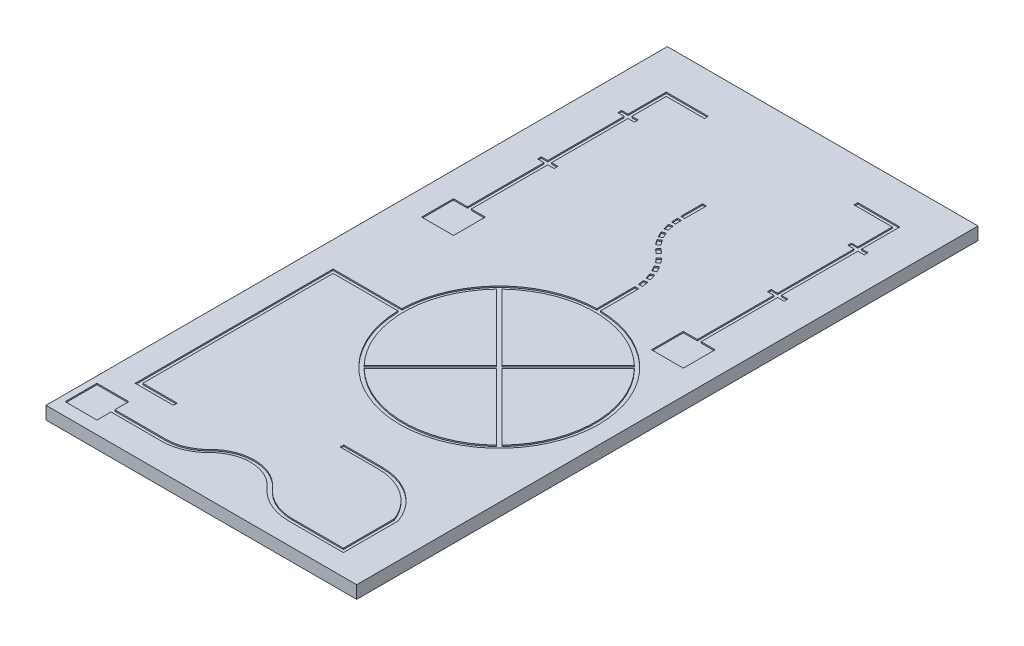
from build123d import *

# Parameters (mm, degrees)
SKETCH1_W           = 2438.4
SKETCH1_H           = 4876.8
BOSS_EXTRUDE1_DEPTH = 100
SKETCH2_W           = 29.994
SKETCH2_H           = 170.927857272
CUT_EXTRUDE1_DEPTH  = 10


with BuildPart() as part:
    # Sketch1 → Boss-Extrude1 (new body)
    with BuildSketch(Plane(origin=(0, 0, 0), x_dir=(1, 0, 0), z_dir=(0, 1, 0))):
        Rectangle(SKETCH1_W, SKETCH1_H)
    extrude(amount=BOSS_EXTRUDE1_DEPTH)

    # Sketch2 → Cut-Extrude1 (cut)
    # profile 1 of 14: a face of its own
    with BuildSketch(Plane(origin=(0, 100, 0), x_dir=(1, 0, 0), z_dir=(0, 1, 0))):
        with BuildLine():
            Line((948.697268509, -2271.953299987), (948.697268509, -1841.953299987))
            ThreePointArc((948.697268509, -1841.953299987), (781.677972321, -1622.395299678), (518.697268509, -1539.074772669))
            Line((518.697268509, -1539.074772669), (218.697268509, -1539.074772669))
            Line((218.697268509, -1539.074772669), (218.697268509, -1567.203186754))
            Line((218.697268509, -1567.203186754), (518.697268509, -1567.203186754))
            ThreePointArc((518.697268509, -1567.203186754), (761.332604312, -1642.506806454), (918.697268509, -1841.953299987))
            Line((918.697268509, -1841.953299987), (918.697268509, -2241.953299987))
            Line((918.697268509, -2241.953299987), (518.697268509, -2241.953299987))
            ThreePointArc((518.697268509, -2241.953299987), (360.930329193, -2207.702777647), (231.567262992, -2111.117569023))
            ThreePointArc((231.567262992, -2111.117569023), (-19.994263519, -1992.142953693), (-277.909673512, -2096.631240126))
            ThreePointArc((-277.909673512, -2096.631240126), (-388.263085664, -2171.917017743), (-519.2, -2198.4))
            Line((-519.2, -2198.4), (-919.2, -2198.4))
            Line((-919.2, -2198.4), (-919.2, -2088.4))
            Line((-919.2, -2088.4), (-1169.2, -2088.4))
            Line((-1169.2, -2088.4), (-1169.2, -2338.4))
            Line((-1169.2, -2338.4), (-919.2, -2338.4))
            Line((-919.2, -2338.4), (-919.2, -2228.4))
            Line((-919.2, -2228.4), (-519.2, -2228.4))
            ThreePointArc((-519.2, -2228.4), (-376.604559833, -2199.558992626), (-256.425361631, -2117.569825155))
            ThreePointArc((-256.425361631, -2117.569825155), (-20.846930763, -2022.130833888), (208.9279, -2130.801553459))
            ThreePointArc((208.9279, -2130.801553459), (348.490866445, -2235.002223915), (518.697268509, -2271.953299987))
            Line((518.697268509, -2271.953299987), (948.697268509, -2271.953299987))
        make_face()
    # profile 2 of 14: a face of its own
    with BuildSketch(Plane(origin=(0, 100, 0), x_dir=(1, 0, 0), z_dir=(0, 1, 0))):
        with BuildLine():
            Line((285, 379.855755893), (285, 679.855755893))
            Line((285, 679.855755893), (315, 679.855755893))
            Line((315, 679.855755893), (315, 379.855755893))
            ThreePointArc((315, 379.855755893), (851.543289326, -951.543289326), (-479.855755893, -415))
            Line((-479.855755893, -415), (-989.2, -415))
            Line((-989.2, -415), (-989.2, -1908.4))
            Line((-989.2, -1908.4), (-719.2, -1908.4))
            Line((-719.2, -1908.4), (-719.2, -1938.4))
            Line((-719.2, -1938.4), (-1019.2, -1938.4))
            Line((-1019.2, -1938.4), (-1019.2, -385))
            Line((-1019.2, -385), (-479.855755893, -385))
            ThreePointArc((-479.855755893, -385), (-251.543289326, 151.543289326), (285, 379.855755893))
        make_face()
        with BuildLine():
            ThreePointArc((840.830091248, -919.617948498), (1050, -399.999999989), (840.830091233, 119.617948514))
            Line((840.830091233, 119.617948514), (321.212142749, -399.999999999))
            Line((321.212142749, -399.999999999), (840.830091248, -919.617948498))
        make_face(mode=Mode.SUBTRACT)
        with BuildLine():
            ThreePointArc((-240.830091247, 119.617948498), (-450, -399.99999999), (-240.830091262, -919.617948483))
            Line((-240.830091262, -919.617948483), (278.78785725, -400))
            Line((278.78785725, -400), (-240.830091247, 119.617948498))
        make_face(mode=Mode.SUBTRACT)
        with BuildLine():
            ThreePointArc((-219.617948483, -940.830091262), (300.00000001, -1150), (819.617948498, -940.830091248))
            Line((819.617948498, -940.830091248), (300, -421.21214275))
            Line((300, -421.21214275), (-219.617948483, -940.830091262))
        make_face(mode=Mode.SUBTRACT)
        with BuildLine():
            ThreePointArc((819.617948513, 140.830091233), (300.00000001, 350), (-219.617948498, 140.830091247))
            Line((-219.617948498, 140.830091247), (300.000000001, -378.787857251))
            Line((300.000000001, -378.787857251), (819.617948513, 140.830091233))
        make_face(mode=Mode.SUBTRACT)
    # profile 3 of 14: a face of its own
    with BuildSketch(Plane(origin=(0, 100, 0), x_dir=(1, 0, 0), z_dir=(0, 1, 0))):
        with BuildLine():
            Line((283.48537458, 707.243266979), (313.363780337, 709.855755893))
            ThreePointArc((313.363780337, 709.855755893), (310.509267678, 734.689146996), (306.307291752, 759.330351401))
            Line((306.307291752, 759.330351401), (276.889903298, 753.485568645))
            ThreePointArc((276.889903298, 753.485568645), (280.817354071, 730.454233152), (283.48537458, 707.243266979))
        make_face()
    # profile 4 of 14: a face of its own
    with BuildSketch(Plane(origin=(0, 100, 0), x_dir=(1, 0, 0), z_dir=(0, 1, 0))):
        with BuildLine():
            Line((270.333610539, 781.525596779), (299.292720231, 789.330351401))
            ThreePointArc((299.292720231, 789.330351401), (292.133221855, 813.280030714), (283.680743009, 836.804510677))
            Line((283.680743009, 836.804510677), (255.741601187, 825.898155504))
            ThreePointArc((255.741601187, 825.898155504), (263.641859342, 803.91058617), (270.333610539, 781.525596779))
        make_face()
    # profile 5 of 14: a face of its own
    with BuildSketch(Plane(origin=(0, 100, 0), x_dir=(1, 0, 0), z_dir=(0, 1, 0))):
        with BuildLine():
            ThreePointArc((243.628805062, 853.938183638), (233.035185878, 874.762268653), (221.323804893, 894.978866774))
            Line((221.323804893, 894.978866774), (246.857174792, 910.713899361))
            ThreePointArc((246.857174792, 910.713899361), (259.387170406, 889.084179851), (270.72127371, 866.804510677))
            Line((270.72127371, 866.804510677), (243.628805062, 853.938183638))
        make_face()
    # profile 6 of 14: a face of its own
    with BuildSketch(Plane(origin=(0, 100, 0), x_dir=(1, 0, 0), z_dir=(0, 1, 0))):
        with BuildLine():
            ThreePointArc((202.481901877, 923.018894908), (188.18918005, 941.500923663), (172.911659512, 959.177593325))
            Line((172.911659512, 959.177593325), (195.061065513, 979.40005714))
            ThreePointArc((195.061065513, 979.40005714), (211.406470515, 960.487804723), (226.698240294, 940.713899361))
            Line((226.698240294, 940.713899361), (202.481901877, 923.018894908))
        make_face()
    # profile 7 of 14: a face of its own
    with BuildSketch(Plane(origin=(0, 100, 0), x_dir=(1, 0, 0), z_dir=(0, 1, 0))):
        with BuildLine():
            Line((144.825754574, 987.217621459), (165.011981963, 1009.40005714))
            ThreePointArc((165.011981963, 1009.40005714), (146.073033678, 1025.714522931), (126.274156062, 1040.973946293))
            Line((126.274156062, 1040.973946293), (108.618763636, 1016.728712798))
            ThreePointArc((108.618763636, 1016.728712798), (127.124133149, 1002.466224119), (144.825754574, 987.217621459))
        make_face()
    # profile 8 of 14: a face of its own
    with BuildSketch(Plane(origin=(0, 100, 0), x_dir=(1, 0, 0), z_dir=(0, 1, 0))):
        with BuildLine():
            ThreePointArc((77.22618432, 1102.631418758), (90.259847646, 1083.460719448), (104.428850873, 1065.113200834))
            Line((104.428850873, 1065.113200834), (81.255026867, 1046.0707767))
            ThreePointArc((81.255026867, 1046.0707767), (65.97699442, 1065.854383225), (51.923166638, 1086.525602039))
            Line((51.923166638, 1086.525602039), (77.22618432, 1102.631418758))
        make_face()
    # profile 9 of 14: a face of its own
    with BuildSketch(Plane(origin=(0, 100, 0), x_dir=(1, 0, 0), z_dir=(0, 1, 0))):
        with BuildLine():
            Line((16.670406388, 1155.4), (44.532414655, 1166.506238397))
            ThreePointArc((44.532414655, 1166.506238397), (53.763601741, 1145.241777983), (64.263689238, 1124.574406251))
            Line((64.263689238, 1124.574406251), (37.946077545, 1110.186100207))
            ThreePointArc((37.946077545, 1110.186100207), (26.624132388, 1132.471138247), (16.670406388, 1155.4))
        make_face()
    # profile 10 of 14: a face of its own
    with BuildSketch(Plane(origin=(0, 100, 0), x_dir=(1, 0, 0), z_dir=(0, 1, 0))):
        with BuildLine():
            Line((23.370750404, 1240.42684097), (-6.147613191, 1235.106479452))
            ThreePointArc((-6.147613191, 1235.106479452), (-0.971721956, 1210.652041971), (5.673377354, 1186.555319834))
            Line((5.673377354, 1186.555319834), (34.333657687, 1195.4))
            ThreePointArc((34.333657687, 1195.4), (28.170924763, 1217.747546054), (23.370750404, 1240.42684097))
        make_face()
    # profile 11 of 14: a face of its own
    with BuildSketch(Plane(origin=(0, 100, 0), x_dir=(1, 0, 0), z_dir=(0, 1, 0))):
        with BuildLine():
            ThreePointArc((-12.7, 1308.4), (-12.054521902, 1285.313106906), (-10.120104275, 1262.298344185))
            Line((-10.120104275, 1262.298344185), (19.686621628, 1265.644853858))
            ThreePointArc((19.686621628, 1265.644853858), (17.892622976, 1286.988979707), (17.294, 1308.4))
            Line((17.294, 1308.4), (17.294, 1311.926257178))
            Line((17.294, 1311.926257178), (-12.682506858, 1312.202101666))
            ThreePointArc((-12.682506858, 1312.202101666), (-12.695626691, 1310.301070954), (-12.7, 1308.4))
        make_face()
    # profile 12 of 14: a face of its own
    with BuildSketch(Plane(origin=(0, 100, 0), x_dir=(1, 0, 0), z_dir=(0, 1, 0))):
        with Locations((2.297, 1422.936071364)):
            Rectangle(SKETCH2_W, SKETCH2_H)
    # profile 13 of 14: a face of its own
    with BuildSketch(Plane(origin=(0, 100, 0), x_dir=(1, 0, 0), z_dir=(0, 1, 0))):
        Polygon((889.297, 565.4), (889.297, 1165.4), (839.297, 1165.4), (839.297, 1195.4), (889.297, 1195.4), (889.297, 1795.4), (839.297, 1795.4), (839.297, 1825.4), (889.297, 1825.4), (889.297, 2095.4), (589.297, 2095.4), (589.297, 2125.4), (919.297, 2125.4), (919.297, 1825.4), (969.297, 1825.4), (969.297, 1795.4), (919.297, 1795.4), (919.297, 1195.4), (969.297, 1195.4), (969.297, 1165.4), (919.297, 1165.4), (919.297, 565.4), (1029.297, 565.4), (1029.297, 315.4), (779.297, 315.4), (779.297, 565.4), align=None)
    # profile 14 of 14: a face of its own
    with BuildSketch(Plane(origin=(0, 100, 0), x_dir=(1, 0, 0), z_dir=(0, 1, 0))):
        Polygon((-1024.703, 565.4), (-914.703, 565.4), (-914.703, 1165.4), (-964.703, 1165.4), (-964.703, 1195.4), (-914.703, 1195.4), (-914.703, 1795.4), (-964.703, 1795.4), (-964.703, 1825.4), (-914.703, 1825.4), (-914.703, 2125.4), (-584.703, 2125.4), (-584.703, 2095.4), (-884.703, 2095.4), (-884.703, 1825.4), (-834.703, 1825.4), (-834.703, 1795.4), (-884.703, 1795.4), (-884.703, 1195.4), (-834.703, 1195.4), (-834.703, 1165.4), (-884.703, 1165.4), (-884.703, 565.4), (-774.703, 565.4), (-774.703, 315.4), (-1024.703, 315.4), align=None)
    extrude(amount=-CUT_EXTRUDE1_DEPTH, mode=Mode.SUBTRACT)


solid = part.part
